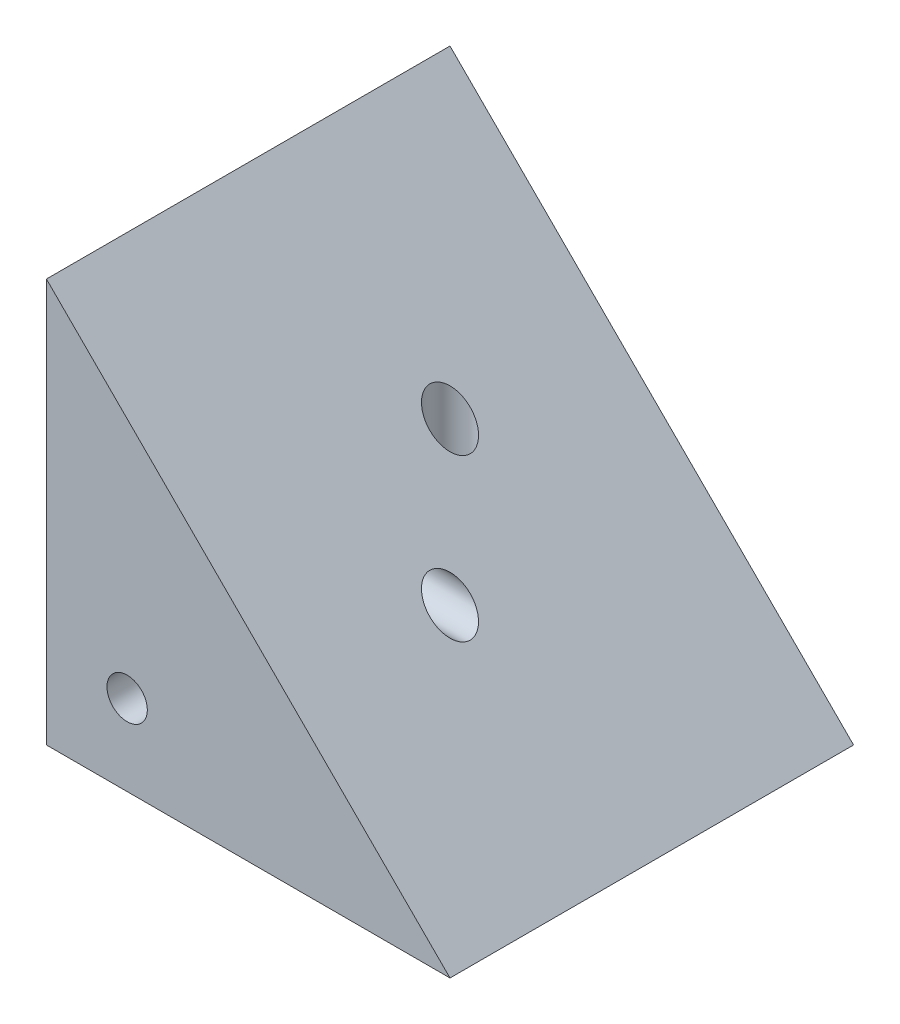
from build123d import *

# Parameters (mm, degrees)
SKETCH_1_R          = 1.25
EXTRUDE_1_DEPTH     = 25
SKETCH_2_R          = 1.25
CUT_EXTRUDE_1_DEPTH = 25
SKETCH_3_R          = 1.25
CUT_EXTRUDE_2_DEPTH = 25


with BuildPart() as part:
    # Эскиз1 → Бобышка-Вытянуть1 (new body)
    with BuildSketch(Plane.XY):
        Polygon((0, 0), (0, 25), (25, 0), align=None)
        with Locations((5, 5)):
            Circle(SKETCH_1_R, mode=Mode.SUBTRACT)
    extrude(amount=EXTRUDE_1_DEPTH)

    # Эскиз2 → Вырез-Вытянуть1 (cut)
    with BuildSketch(Plane.ZY):
        with Locations((15, 10)):
            Circle(SKETCH_2_R)
    extrude(amount=-CUT_EXTRUDE_1_DEPTH, mode=Mode.SUBTRACT)

    # Эскиз3 → Вырез-Вытянуть2 (cut)
    with BuildSketch(Plane.XZ):
        with Locations((10, 10)):
            Circle(SKETCH_3_R)
    extrude(amount=-CUT_EXTRUDE_2_DEPTH, mode=Mode.SUBTRACT)


solid = part.part
